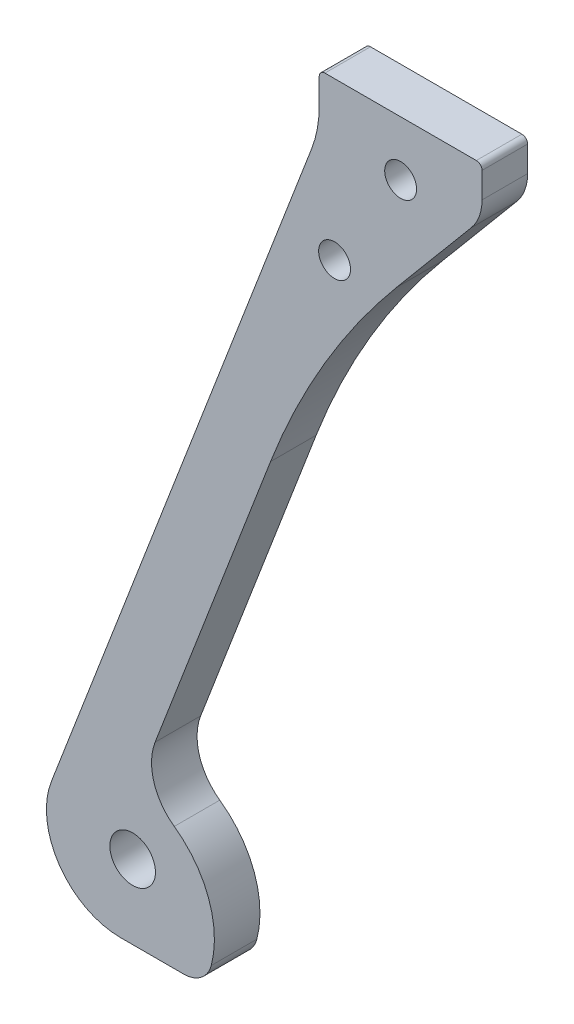
from build123d import *

# Parameters (mm, degrees)
SKETCH_1_R               = 1.4
SKETCH_1_R_2             = 2
EXTRUDE_1_DEPTH          = 4
FILLET_1_R               = 66
CUT_EXTRUDE_1_DEPTH      = 145.092986744
CUT_EXTRUDE_1_DEPTH_BACK = 145.092986744
SKETCH_2_W               = 17.6
SKETCH_2_H               = 11.1
FILLET_3_R               = 0.5


with BuildPart() as part:
    # 草图1 → 凸台-拉伸1 (new body)
    with BuildSketch(Plane.XY):
        with BuildLine():
            Line((-97.873903688, 10.8), (-85.873903688, 10.8))
            ThreePointArc((-85.873903688, 10.8), (-83.8940047, 9.979898987), (-83.073903688, 8))
            ThreePointArc((-83.073903688, 8), (-83.1796222, 7.237866637), (-83.48879459, 6.53328442))
            Line((-83.48879459, 6.53328442), (-84.431683177, 5))
            ThreePointArc((-84.431683177, 5), (-84.652520599, 4.496726988), (-84.728033822, 3.952346014))
            Line((-84.728033822, 3.952346014), (-84.728033822, -3.047653986))
            ThreePointArc((-84.728033822, -3.047653986), (-84.969263339, -4.415734559), (-85.66385605, -5.618804425))
            Line((-85.66385605, -5.618804425), (-99.33833884, -21.915418417))
            Line((-99.33833884, -21.915418417), (-113.429667528, -58.624584688))
            ThreePointArc((-113.429667528, -58.624584688), (-113.541543089, -61.69465347), (-111.747141559, -64.18823756))
            ThreePointArc((-111.747141559, -64.18823756), (-108.724804348, -68.153933924), (-108.495917327, -73.134785316))
            ThreePointArc((-108.495917327, -73.134785316), (-109.387053216, -74.479515508), (-110.913984241, -75))
            Line((-110.913984241, -75), (-116.470682802, -75))
            ThreePointArc((-116.470682802, -75), (-121.827503028, -72.18164054), (-122.538955574, -66.170608328))
            Line((-122.538955574, -66.170608328), (-99.683969288, -6.631333481))
            ThreePointArc((-99.683969288, -6.631333481), (-99.187224477, -4.870009241), (-99.019773553, -3.047653986))
            Line((-99.019773553, -3.047653986), (-99.019773553, 3.952346014))
            ThreePointArc((-99.019773553, 3.952346014), (-99.095286776, 4.496726988), (-99.316124198, 5))
            Line((-99.316124198, 5), (-100.259012785, 6.53328442))
            ThreePointArc((-100.259012785, 6.53328442), (-100.568185176, 7.237866637), (-100.673903688, 8))
            ThreePointArc((-100.673903688, 8), (-99.853802675, 9.979898987), (-97.873903688, 10.8))
        make_face()
        with Locations((-85.873903688, 8)):
            Circle(SKETCH_1_R, mode=Mode.SUBTRACT)
        with Locations((-97.873903688, 8)):
            Circle(SKETCH_1_R, mode=Mode.SUBTRACT)
        with Locations((-97.673903688, -14.1)):
            Circle(SKETCH_1_R, mode=Mode.SUBTRACT)
        with Locations((-91.873903688, -5.1)):
            Circle(SKETCH_1_R, mode=Mode.SUBTRACT)
        with Locations((-115.399537808, -68.5)):
            Circle(SKETCH_1_R_2, mode=Mode.SUBTRACT)
        with BuildLine():
            Line((-88.763801636, 5.1), (-94.984005739, 5.1))
            ThreePointArc((-94.984005739, 5.1), (-95.172987976, 5.13708995), (-95.333932845, 5.242857143))
            ThreePointArc((-95.333932845, 5.242857143), (-95.615325044, 5.241421356), (-95.61676083, 4.960029158))
            ThreePointArc((-95.61676083, 4.960029158), (-95.510993638, 4.799084288), (-95.473903688, 4.610102051))
            Line((-95.473903688, 4.610102051), (-95.473903688, 0.389897949))
            ThreePointArc((-95.473903688, 0.389897949), (-95.510993638, 0.200915712), (-95.61676083, 0.039970842))
            ThreePointArc((-95.61676083, 0.039970842), (-95.615325044, -0.241421356), (-95.333932845, -0.242857143))
            ThreePointArc((-95.333932845, -0.242857143), (-95.172987976, -0.13708995), (-94.984005739, -0.1))
            Line((-94.984005739, -0.1), (-88.763801636, -0.1))
            ThreePointArc((-88.763801636, -0.1), (-88.5748194, -0.13708995), (-88.41387453, -0.242857143))
            ThreePointArc((-88.41387453, -0.242857143), (-88.132482331, -0.241421356), (-88.131046545, 0.039970842))
            ThreePointArc((-88.131046545, 0.039970842), (-88.236813737, 0.200915712), (-88.273903688, 0.389897949))
            Line((-88.273903688, 0.389897949), (-88.273903688, 4.610102051))
            ThreePointArc((-88.273903688, 4.610102051), (-88.236813737, 4.799084288), (-88.131046545, 4.960029158))
            ThreePointArc((-88.131046545, 4.960029158), (-88.132482331, 5.241421356), (-88.41387453, 5.242857143))
            ThreePointArc((-88.41387453, 5.242857143), (-88.5748194, 5.13708995), (-88.763801636, 5.1))
        make_face(mode=Mode.SUBTRACT)
    extrude(amount=EXTRUDE_1_DEPTH)

    # 圆角1
    fillet_1_edges = [part.edges().sort_by_distance(p)[0] for p in [
        (-99.33833884, -21.915418417, 2),
    ]]
    fillet(fillet_1_edges, radius=FILLET_1_R)

    # 草图2 → 切除-拉伸1 (cut, two sides: drawn at the far end of the back side and taken through both)
    with BuildSketch(Plane.XY.offset(4).offset(-CUT_EXTRUDE_1_DEPTH_BACK)):
        with Locations((-91.873903688, 5.25)):
            Rectangle(SKETCH_2_W, SKETCH_2_H)
    extrude(amount=CUT_EXTRUDE_1_DEPTH + CUT_EXTRUDE_1_DEPTH_BACK, mode=Mode.SUBTRACT)

    # 圆角3
    fillet_3_edges = [part.edges().sort_by_distance(p)[0] for p in [
        (-99.019773553, -0.3, 2),
        (-84.728033822, -0.3, 2),
    ]]
    fillet(fillet_3_edges, radius=FILLET_3_R)


solid = part.part
